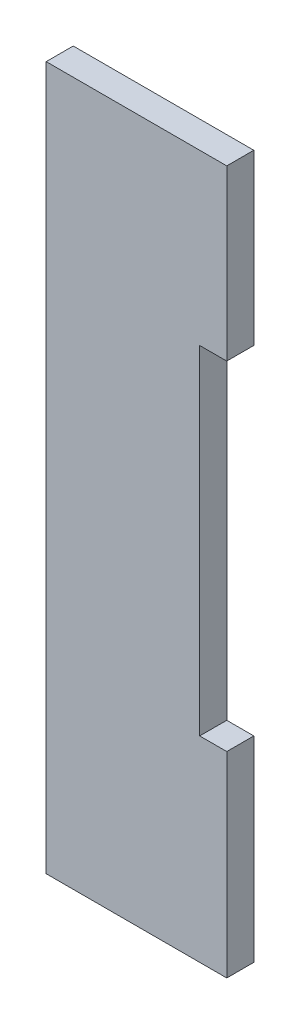
from build123d import *

# Parameters (mm, degrees)
EXTRUDE_1_DEPTH = 4


with BuildPart() as part:
    # Эскиз1 → Бобышка-Вытянуть1 (new body)
    with BuildSketch(Plane.XY):
        Polygon((3, -25.582818043), (3, 24.417181957), (7, 24.417181957), (7, 49.417181957), (-19.7, 49.417181957), (-19.7, -0.582818043), (-19.7, -50.582818043), (-19.7, -54.582818043), (7, -54.582818043), (7, -50.582818043), (7, -25.582818043), align=None)
    extrude(amount=EXTRUDE_1_DEPTH)


solid = part.part
